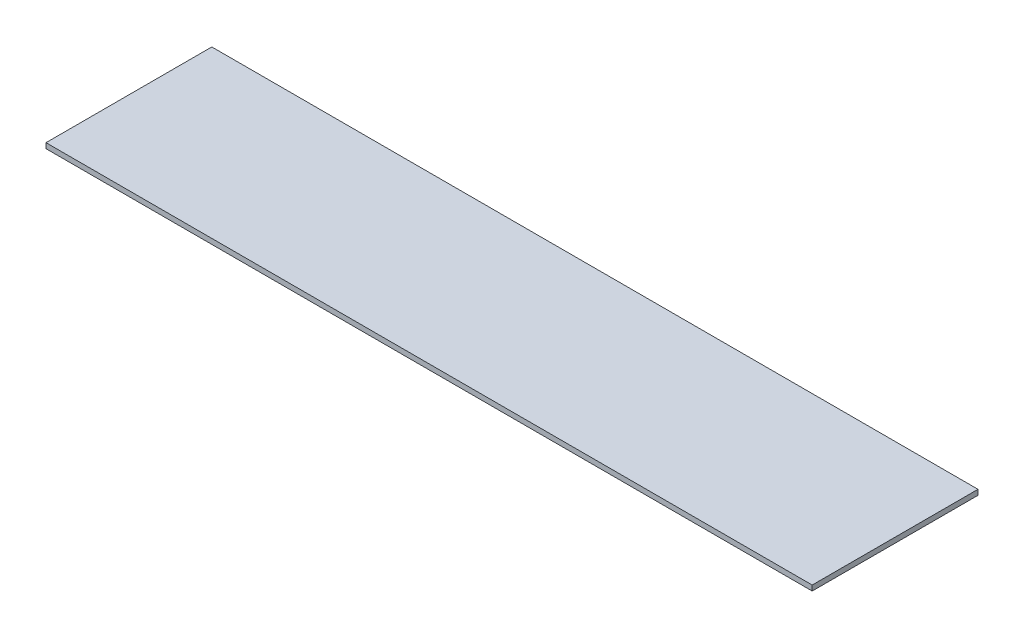
from build123d import *

# Parameters (mm, degrees)
CROQUIS1_W              = 439
CROQUIS1_H              = 95
SALIENTE_EXTRUIR1_DEPTH = 3


with BuildPart() as part:
    # Croquis1 → Saliente-Extruir1 (new body)
    with BuildSketch(Plane(origin=(0, 0, 0), x_dir=(1, 0, 0), z_dir=(0, 1, 0))):
        Rectangle(CROQUIS1_W, CROQUIS1_H)
    extrude(amount=SALIENTE_EXTRUIR1_DEPTH)


solid = part.part
